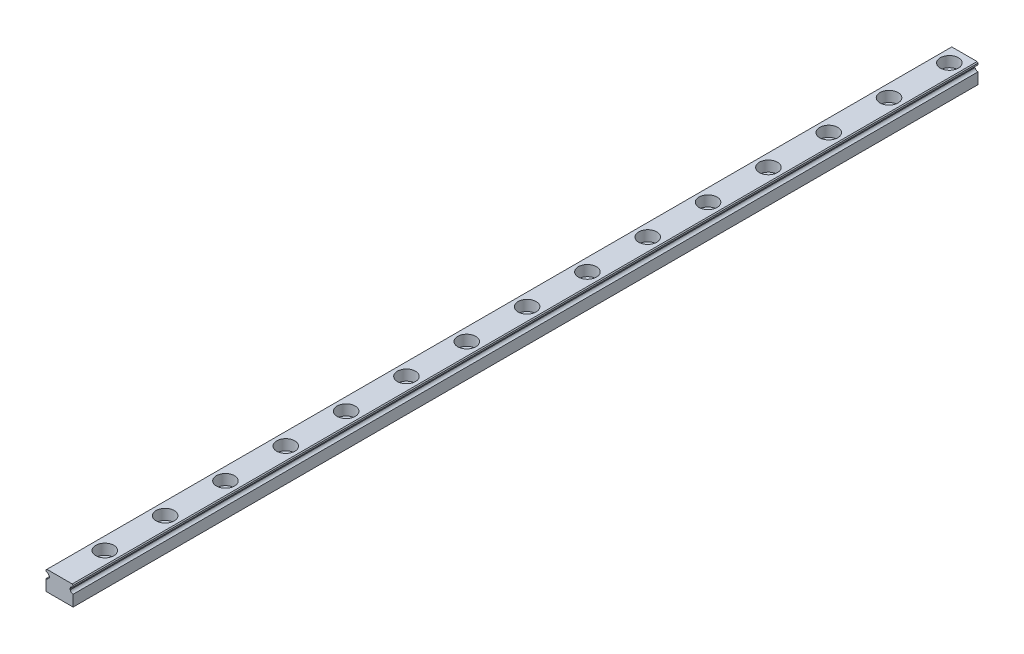
from build123d import *

# Parameters (mm, degrees)
EXTRUDE1_DEPTH  = 300
SKETCH2_R       = 3
EXTRUDE2_DEPTH  = 3.5
SKETCH_R        = 1.75
EXTRUDE3_DEPTH  = 301.104148588
LPATTERN1_COUNT = 40
LPATTERN1_PITCH = 20
CHAMFER1_SIZE   = 0.3


with BuildPart() as part:
    # Sketch1 → Extrude1 (new body)
    with BuildSketch(Plane.XY):
        with BuildLine():
            Line((-4.5, -3.25), (4.5, -3.25))
            Line((4.5, -3.25), (4.5, 0.45))
            ThreePointArc((4.5, 0.45), (3.887627564, 0.659430585), (3.531754163, 1.2))
            Line((3.531754163, 1.2), (3.4, 1.2))
            Line((3.4, 1.2), (3.4, 1.7))
            Line((3.4, 1.7), (3.531754163, 1.7))
            ThreePointArc((3.531754163, 1.7), (3.887627564, 2.240569415), (4.5, 2.45))
            Line((4.5, 2.45), (4.5, 3.25))
            Line((4.5, 3.25), (-4.5, 3.25))
            Line((-4.5, 3.25), (-4.5, 2.45))
            ThreePointArc((-4.5, 2.45), (-3.887627564, 2.240569415), (-3.531754163, 1.7))
            Line((-3.531754163, 1.7), (-3.4, 1.7))
            Line((-3.4, 1.7), (-3.4, 1.2))
            Line((-3.4, 1.2), (-3.531754163, 1.2))
            ThreePointArc((-3.531754163, 1.2), (-3.887627564, 0.659430585), (-4.5, 0.45))
            Line((-4.5, 0.45), (-4.5, -3.25))
        make_face()
    extrude(amount=EXTRUDE1_DEPTH)

    # Sketch2 → Extrude2 (cut)
    with BuildSketch(Plane(origin=(0, 3.25, 0), x_dir=(1, 0, 0), z_dir=(0, 1, 0))):
        with Locations((0, -5)):
            Circle(SKETCH2_R)
    extrude2 = extrude(amount=-EXTRUDE2_DEPTH, mode=Mode.SUBTRACT)

    # Sketch → Extrude3 (cut, through all)
    with BuildSketch(Plane(origin=(0, 3.25, 0), x_dir=(1, 0, 0), z_dir=(0, 1, 0))):
        with Locations((0, -5)):
            Circle(SKETCH_R)
    extrude3 = extrude(amount=-EXTRUDE3_DEPTH, mode=Mode.SUBTRACT)

    # LPattern1: Extrude2, Extrude3 ×40
    with Locations(*[(0, 0, i * LPATTERN1_PITCH) for i in range(1, LPATTERN1_COUNT)]):
        add(extrude2, mode=Mode.SUBTRACT)
        add(extrude3, mode=Mode.SUBTRACT)

    # Chamfer1
    chamfer1_edges = [part.edges().sort_by_distance(p)[0] for p in [
        (4.5, 3.25, 150),
        (-4.5, 3.25, 150),
    ]]
    chamfer(chamfer1_edges, length=CHAMFER1_SIZE)


solid = part.part
